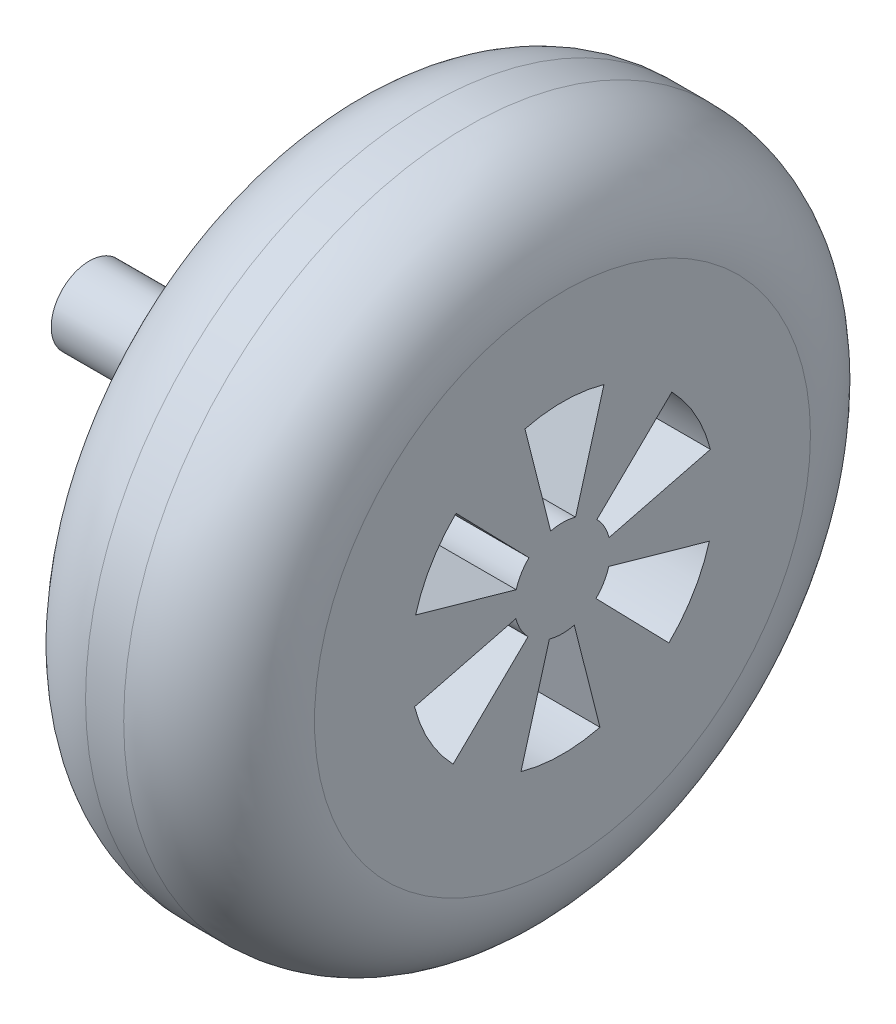
from build123d import *
from build123d.topology import SkipClean

# Parameters (mm, degrees)
SKETCH1_R           = 90
BOSS_EXTRUDE1_DEPTH = 60
FILLET2_R           = 25
CUT_EXTRUDE5_DEPTH  = 141.712472859
SKETCH8_R           = 10
BOSS_EXTRUDE2_DEPTH = 124
SKETCH9_R           = 12.595659068
BOSS_EXTRUDE3_DEPTH = 61


with BuildPart() as part:
    # Sketch1 → Boss-Extrude1 (new body)
    with BuildSketch(Plane(origin=(0, 0, 0), x_dir=(0, 0, -1), z_dir=(1, 0, 0))):
        Circle(SKETCH1_R)
    extrude(amount=BOSS_EXTRUDE1_DEPTH)

    # Fillet2
    fillet2_edges = [part.edges().sort_by_distance(p)[0] for p in [
        (0, 0, 90),
        (60, 0, 90),
    ]]
    fillet(fillet2_edges, radius=FILLET2_R)

    # Sketch3 → Cut-Extrude5 (cut, through all)
    with BuildSketch(Plane(origin=(60, 0, 0), x_dir=(0, 0, -1), z_dir=(1, 0, 0))):
        with BuildLine():
            Line((-9.829866808, 38.773363519), (-2.457466702, 9.69334088))
            ThreePointArc((-2.457466702, 9.69334088), (0.135090676, 9.999087484), (2.718441847, 9.6234128))
            Line((2.718441847, 9.6234128), (10.873767388, 38.493651201))
            ThreePointArc((10.873767388, 38.493651201), (0.540362703, 39.996349935), (-9.829866808, 38.773363519))
        make_face()
        with BuildLine():
            Line((28.663784394, 27.89959613), (7.165946098, 6.974899033))
            ThreePointArc((7.165946098, 6.974899033), (8.727009114, 4.882551785), (9.69334088, 2.457466702))
            Line((9.69334088, 2.457466702), (38.773363519, 9.829866808))
            ThreePointArc((38.773363519, 9.829866808), (34.908036454, 19.53020714), (28.663784394, 27.89959613))
        make_face()
        with BuildLine():
            Line((38.493651201, -10.873767388), (9.6234128, -2.718441847))
            ThreePointArc((9.6234128, -2.718441847), (8.591918438, -5.116535699), (6.974899033, -7.165946098))
            Line((6.974899033, -7.165946098), (27.89959613, -28.663784394))
            ThreePointArc((27.89959613, -28.663784394), (34.367673751, -20.466142796), (38.493651201, -10.873767388))
        make_face()
        with BuildLine():
            ThreePointArc((2.457466702, -9.69334088), (-0.135090676, -9.999087484), (-2.718441847, -9.6234128))
            Line((-2.718441847, -9.6234128), (-10.873767388, -38.493651201))
            ThreePointArc((-10.873767388, -38.493651201), (-0.540362703, -39.996349935), (9.829866808, -38.773363519))
            Line((9.829866808, -38.773363519), (2.457466702, -9.69334088))
        make_face()
        with BuildLine():
            ThreePointArc((-7.165946098, -6.974899033), (-8.727009114, -4.882551785), (-9.69334088, -2.457466702))
            Line((-9.69334088, -2.457466702), (-38.773363519, -9.829866808))
            ThreePointArc((-38.773363519, -9.829866808), (-34.908036454, -19.53020714), (-28.663784394, -27.89959613))
            Line((-28.663784394, -27.89959613), (-7.165946098, -6.974899033))
        make_face()
        with BuildLine():
            ThreePointArc((-9.6234128, 2.718441847), (-8.591918438, 5.116535699), (-6.974899033, 7.165946098))
            Line((-6.974899033, 7.165946098), (-27.89959613, 28.663784394))
            ThreePointArc((-27.89959613, 28.663784394), (-34.367673751, 20.466142796), (-38.493651201, 10.873767388))
            Line((-38.493651201, 10.873767388), (-9.6234128, 2.718441847))
        make_face()
    extrude(amount=-CUT_EXTRUDE5_DEPTH, mode=Mode.SUBTRACT)

    # Sketch8 → Boss-Extrude2 (add)
    with SkipClean():  # the faces are left unmerged after this step: merging them gives an invalid solid
        with BuildSketch(Plane(origin=(60, 0, 0), x_dir=(0, 0, -1), z_dir=(1, 0, 0))):
            Circle(SKETCH8_R)
        extrude(amount=-BOSS_EXTRUDE2_DEPTH)

    # Sketch9 → Boss-Extrude3 (add)
    with BuildSketch(Plane(origin=(60, 0, 0), x_dir=(0, 0, -1), z_dir=(1, 0, 0))):
        Circle(SKETCH9_R)
    extrude(amount=-BOSS_EXTRUDE3_DEPTH)


solid = part.part
